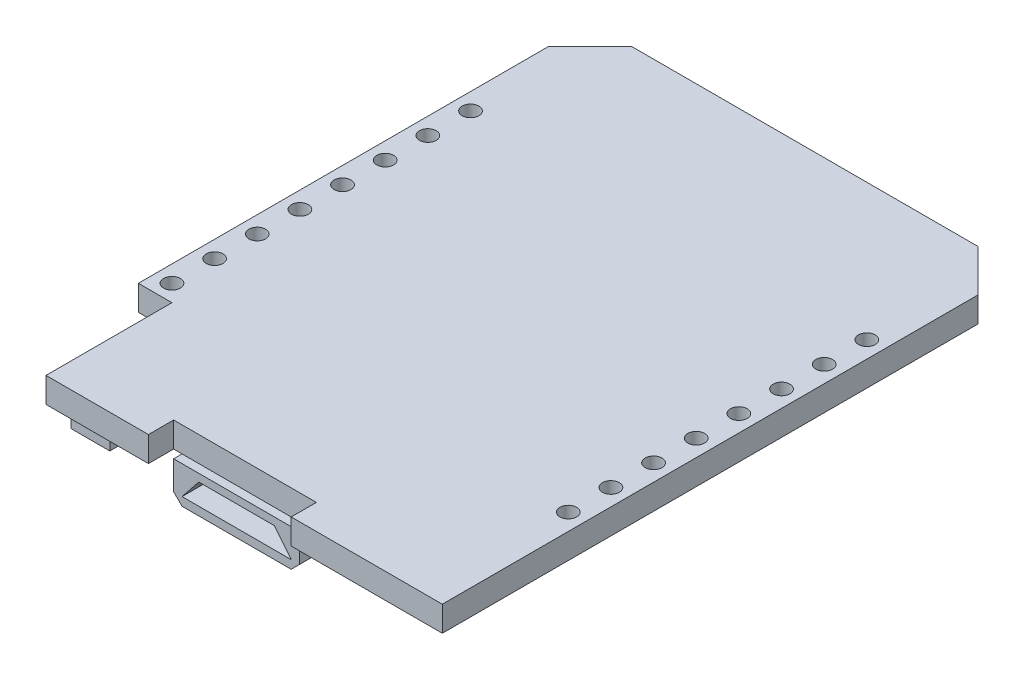
from build123d import *

# Parameters (mm, degrees)
SKETCH1_R             = 0.5
PCB_DEPTH             = 1.5
SKETCH5_W             = 7.5
SKETCH5_H             = 5.6
BOSS_EXTRUDE4_DEPTH   = 2.2
CHAMFER1_SIZE         = 0.5
CUT_EXTRUDE1_DEPTH    = 4
SKETCH5_4_W           = 2.3
SKETCH5_4_H           = 4.5
BUTTON_BODY_DEPTH     = 2
SKETCH11_W            = 2
SKETCH11_H            = 0.89493309
BUTTON_ACTUATOR_DEPTH = 1
SKETCH5_5_W           = 1.5
SKETCH5_5_H           = 1
COMPONENTS1_DEPTH     = 1
SKETCH5_5_W_2         = 10.115707705
SKETCH5_5_H_2         = 4.574950916
COMPONENTS1_2_DEPTH   = 1
COMPONENTS1_3_DEPTH   = 1
COMPONENTS1_4_DEPTH   = 1
SKETCH5_5_W_3         = 1
SKETCH5_5_H_3         = 1.5
COMPONENTS1_5_DEPTH   = 1
SKETCH5_6_W           = 1.5
SKETCH5_6_H           = 1
COMPONENTS_2_DEPTH    = 0.5
COMPONENTS_2_2_DEPTH  = 0.5
COMPONENTS_2_3_DEPTH  = 0.5
COMPONENTS_2_4_DEPTH  = 0.5
COMPONENTS_2_5_DEPTH  = 0.5
COMPONENTS_2_6_DEPTH  = 0.5
COMPONENTS_2_7_DEPTH  = 0.5
COMPONENTS_2_8_DEPTH  = 0.5
COMPONENTS_2_9_DEPTH  = 0.5
SKETCH5_6_W_2         = 1
SKETCH5_6_H_2         = 2.730487257
COMPONENTS_2_10_DEPTH = 0.5
COMPONENTS_2_11_DEPTH = 0.5
SKETCH5_6_H_3         = 1.5
COMPONENTS_2_12_DEPTH = 0.5
COMPONENTS_2_13_DEPTH = 0.5
COMPONENTS_2_14_DEPTH = 0.5
COMPONENTS_2_15_DEPTH = 0.5
COMPONENTS_2_16_DEPTH = 0.5
COMPONENTS_2_17_DEPTH = 0.5
COMPONENTS_2_18_DEPTH = 0.5
COMPONENTS_2_19_DEPTH = 0.5
COMPONENTS_2_20_DEPTH = 0.5
COMPONENTS_2_21_DEPTH = 0.5


with BuildPart() as part:
    # Sketch1 → PCB (new body)
    with BuildSketch(Plane(origin=(0, 0, 0), x_dir=(1, 0, 0), z_dir=(0, 1, 0))):
        Polygon((0, 0), (0, 31.9), (-2.5, 34.4), (-23.1, 34.4), (-25.6, 31.9), (-25.6, 7.5), (-23.6, 7.5), (-23.6, 0), (-17.5, 0), (-17.5, 1.5), (-9, 1.5), (-9, 0), align=None)
        with Locations(Location((-24.6, 8.5, 0), (0, 0, 270))):
            Circle(SKETCH1_R, mode=Mode.SUBTRACT)
        with Locations(Location((-1, 8.5, 0), (0, 0, 270))):
            Circle(SKETCH1_R, mode=Mode.SUBTRACT)
        with Locations(Location((-24.6, 11.04, 0), (0, 0, 270))):
            Circle(SKETCH1_R, mode=Mode.SUBTRACT)
        with Locations(Location((-1, 11.04, 0), (0, 0, 270))):
            Circle(SKETCH1_R, mode=Mode.SUBTRACT)
        with Locations(Location((-24.6, 13.58, 0), (0, 0, 270))):
            Circle(SKETCH1_R, mode=Mode.SUBTRACT)
        with Locations(Location((-1, 13.58, 0), (0, 0, 270))):
            Circle(SKETCH1_R, mode=Mode.SUBTRACT)
        with Locations(Location((-24.6, 16.12, 0), (0, 0, 270))):
            Circle(SKETCH1_R, mode=Mode.SUBTRACT)
        with Locations(Location((-1, 16.12, 0), (0, 0, 270))):
            Circle(SKETCH1_R, mode=Mode.SUBTRACT)
        with Locations(Location((-24.6, 18.66, 0), (0, 0, 270))):
            Circle(SKETCH1_R, mode=Mode.SUBTRACT)
        with Locations(Location((-1, 18.66, 0), (0, 0, 270))):
            Circle(SKETCH1_R, mode=Mode.SUBTRACT)
        with Locations(Location((-24.6, 21.2, 0), (0, 0, 270))):
            Circle(SKETCH1_R, mode=Mode.SUBTRACT)
        with Locations(Location((-1, 21.2, 0), (0, 0, 270))):
            Circle(SKETCH1_R, mode=Mode.SUBTRACT)
        with Locations(Location((-24.6, 23.74, 0), (0, 0, 270))):
            Circle(SKETCH1_R, mode=Mode.SUBTRACT)
        with Locations(Location((-1, 23.74, 0), (0, 0, 270))):
            Circle(SKETCH1_R, mode=Mode.SUBTRACT)
        with Locations(Location((-24.6, 26.28, 0), (0, 0, 270))):
            Circle(SKETCH1_R, mode=Mode.SUBTRACT)
        with Locations(Location((-1, 26.28, 0), (0, 0, 270))):
            Circle(SKETCH1_R, mode=Mode.SUBTRACT)
    extrude(amount=PCB_DEPTH)


with BuildPart() as body_2:
    # Sketch5 → Boss-Extrude4 (new body)
    with BuildSketch(Plane.XZ):
        with Locations((-13.25, -3.8)):
            Rectangle(SKETCH5_W, SKETCH5_H)
    extrude(amount=BOSS_EXTRUDE4_DEPTH)

    # Chamfer1
    chamfer1_edges = [body_2.edges().sort_by_distance(p)[0] for p in [
        (-17, -2.2, -3.8),
        (-9.5, -2.2, -3.8),
    ]]
    chamfer(chamfer1_edges, length=CHAMFER1_SIZE)

    # Sketch12 → Cut-Extrude1 (cut)
    with BuildSketch(Plane.XY.offset(-1)):
        Polygon((-15.5, -0.45), (-11, -0.45), (-10, -1.7), (-16.5, -1.7), align=None)
    extrude(amount=-CUT_EXTRUDE1_DEPTH, mode=Mode.SUBTRACT)


with BuildPart() as body_3:
    # Sketch5<4> → Button Body (new body)
    with BuildSketch(Plane.XZ):
        with Locations((-22.45, -3.75)):
            Rectangle(SKETCH5_4_W, SKETCH5_4_H)
    extrude(amount=BUTTON_BODY_DEPTH)


with BuildPart() as body_4:
    # Sketch11 → Button Actuator (new body)
    with BuildSketch(Plane.ZY.offset(23.6)):
        with Locations((-3.75, -1)):
            Rectangle(SKETCH11_W, SKETCH11_H)
    extrude(amount=BUTTON_ACTUATOR_DEPTH)


with BuildPart() as body_5:
    # Sketch5<5> → Components1 (new body)
    with BuildSketch(Plane.XZ):
        with Locations((-3.164431534, -3.205591578)):
            Rectangle(SKETCH5_5_W, SKETCH5_5_H)
    extrude(amount=COMPONENTS1_DEPTH)


with BuildPart() as body_6:
    # Sketch5<5> → Components1 2 (new body)
    with BuildSketch(Plane.XZ):
        with Locations((-13.706412385, -12.112524542)):
            Rectangle(SKETCH5_5_W_2, SKETCH5_5_H_2)
    extrude(amount=COMPONENTS1_2_DEPTH)


with BuildPart() as body_7:
    # Sketch5<5> → Components1 3 (new body)
    with BuildSketch(Plane.XZ):
        with Locations((-12.85, -27.9)):
            Rectangle(SKETCH5_5_W, SKETCH5_5_H)
    extrude(amount=COMPONENTS1_3_DEPTH)


with BuildPart() as body_8:
    # Sketch5<5> → Components1 4 (new body)
    with BuildSketch(Plane.XZ):
        with Locations((-12.85, -17.9)):
            Rectangle(SKETCH5_5_W, SKETCH5_5_H)
    extrude(amount=COMPONENTS1_4_DEPTH)


with BuildPart() as body_9:
    # Sketch5<5> → Components1 5 (new body)
    with BuildSketch(Plane.XZ):
        with Locations((-7.859161772, -2.586878922)):
            Rectangle(SKETCH5_5_W_3, SKETCH5_5_H_3)
    extrude(amount=COMPONENTS1_5_DEPTH)


with BuildPart() as body_10:
    # Sketch5<6> → Components 2 (new body)
    with BuildSketch(Plane.XZ):
        with Locations((-19.35, -15.9)):
            Rectangle(SKETCH5_6_W, SKETCH5_6_H)
    extrude(amount=COMPONENTS_2_DEPTH)


with BuildPart() as body_11:
    # Sketch5<6> → Components 2 2 (new body)
    with BuildSketch(Plane.XZ):
        with Locations((-19.35, -17.9)):
            Rectangle(SKETCH5_6_W, SKETCH5_6_H)
    extrude(amount=COMPONENTS_2_2_DEPTH)


with BuildPart() as body_12:
    # Sketch5<6> → Components 2 3 (new body)
    with BuildSketch(Plane.XZ):
        with Locations((-19.35, -19.9)):
            Rectangle(SKETCH5_6_W, SKETCH5_6_H)
    extrude(amount=COMPONENTS_2_3_DEPTH)


with BuildPart() as body_13:
    # Sketch5<6> → Components 2 4 (new body)
    with BuildSketch(Plane.XZ):
        with Locations((-19.35, -21.9)):
            Rectangle(SKETCH5_6_W, SKETCH5_6_H)
    extrude(amount=COMPONENTS_2_4_DEPTH)


with BuildPart() as body_14:
    # Sketch5<6> → Components 2 5 (new body)
    with BuildSketch(Plane.XZ):
        with Locations((-19.35, -23.9)):
            Rectangle(SKETCH5_6_W, SKETCH5_6_H)
    extrude(amount=COMPONENTS_2_5_DEPTH)


with BuildPart() as body_15:
    # Sketch5<6> → Components 2 6 (new body)
    with BuildSketch(Plane.XZ):
        with Locations((-19.35, -25.9)):
            Rectangle(SKETCH5_6_W, SKETCH5_6_H)
    extrude(amount=COMPONENTS_2_6_DEPTH)


with BuildPart() as body_16:
    # Sketch5<6> → Components 2 7 (new body)
    with BuildSketch(Plane.XZ):
        with Locations((-19.35, -27.9)):
            Rectangle(SKETCH5_6_W, SKETCH5_6_H)
    extrude(amount=COMPONENTS_2_7_DEPTH)


with BuildPart() as body_17:
    # Sketch5<6> → Components 2 8 (new body)
    with BuildSketch(Plane.XZ):
        with Locations((-12.85, -23.9)):
            Rectangle(SKETCH5_6_W, SKETCH5_6_H)
    extrude(amount=COMPONENTS_2_8_DEPTH)


with BuildPart() as body_18:
    # Sketch5<6> → Components 2 9 (new body)
    with BuildSketch(Plane.XZ):
        with Locations((-12.85, -21.9)):
            Rectangle(SKETCH5_6_W, SKETCH5_6_H)
    extrude(amount=COMPONENTS_2_9_DEPTH)


with BuildPart() as body_19:
    # Sketch5<6> → Components 2 10 (new body)
    with BuildSketch(Plane.XZ):
        with Locations((-18.856957667, -6.674141125)):
            Rectangle(SKETCH5_6_W_2, SKETCH5_6_H_2)
    extrude(amount=COMPONENTS_2_10_DEPTH)


with BuildPart() as body_20:
    # Sketch5<6> → Components 2 11 (new body)
    with BuildSketch(Plane.XZ):
        with Locations((-4.664431534, -1.336878922)):
            Rectangle(SKETCH5_6_W, SKETCH5_6_H)
    extrude(amount=COMPONENTS_2_11_DEPTH)


with BuildPart() as body_21:
    # Sketch5<6> → Components 2 12 (new body)
    with BuildSketch(Plane.XZ):
        with Locations((-7.752386826, -6.644686373)):
            Rectangle(SKETCH5_6_W_2, SKETCH5_6_H_3)
    extrude(amount=COMPONENTS_2_12_DEPTH)


with BuildPart() as body_22:
    # Sketch5<6> → Components 2 13 (new body)
    with BuildSketch(Plane.XZ):
        with Locations((-3.619512743, -6.732470951)):
            Rectangle(SKETCH5_6_W, SKETCH5_6_H)
    extrude(amount=COMPONENTS_2_13_DEPTH)


with BuildPart() as body_23:
    # Sketch5<6> → Components 2 14 (new body)
    with BuildSketch(Plane.XZ):
        with Locations((-4.976980779, -10.171565746)):
            Rectangle(SKETCH5_6_W_2, SKETCH5_6_H_3)
    extrude(amount=COMPONENTS_2_14_DEPTH)


with BuildPart() as body_24:
    # Sketch5<6> → Components 2 15 (new body)
    with BuildSketch(Plane.XZ):
        with Locations((-6.576760368, -10.171565746)):
            Rectangle(SKETCH5_6_W_2, SKETCH5_6_H_3)
    extrude(amount=COMPONENTS_2_15_DEPTH)


with BuildPart() as body_25:
    # Sketch5<6> → Components 2 16 (new body)
    with BuildSketch(Plane.XZ):
        with Locations((-6.35, -13.9)):
            Rectangle(SKETCH5_6_W, SKETCH5_6_H)
    extrude(amount=COMPONENTS_2_16_DEPTH)


with BuildPart() as body_26:
    # Sketch5<6> → Components 2 17 (new body)
    with BuildSketch(Plane.XZ):
        with Locations((-6.35, -15.9)):
            Rectangle(SKETCH5_6_W, SKETCH5_6_H)
    extrude(amount=COMPONENTS_2_17_DEPTH)


with BuildPart() as body_27:
    # Sketch5<6> → Components 2 18 (new body)
    with BuildSketch(Plane.XZ):
        with Locations((-6.35, -17.9)):
            Rectangle(SKETCH5_6_W, SKETCH5_6_H)
    extrude(amount=COMPONENTS_2_18_DEPTH)


with BuildPart() as body_28:
    # Sketch5<6> → Components 2 19 (new body)
    with BuildSketch(Plane.XZ):
        with Locations((-6.35, -19.9)):
            Rectangle(SKETCH5_6_W, SKETCH5_6_H)
    extrude(amount=COMPONENTS_2_19_DEPTH)


with BuildPart() as body_29:
    # Sketch5<6> → Components 2 20 (new body)
    with BuildSketch(Plane.XZ):
        with Locations((-6.35, -25.9)):
            Rectangle(SKETCH5_6_W, SKETCH5_6_H)
    extrude(amount=COMPONENTS_2_20_DEPTH)


with BuildPart() as body_30:
    # Sketch5<6> → Components 2 21 (new body)
    with BuildSketch(Plane.XZ):
        with Locations((-6.35, -27.9)):
            Rectangle(SKETCH5_6_W, SKETCH5_6_H)
    extrude(amount=COMPONENTS_2_21_DEPTH)


solid = Compound([part.part, body_2.part, body_3.part, body_4.part, body_5.part, body_6.part, body_7.part, body_8.part, body_9.part, body_10.part, body_11.part, body_12.part, body_13.part, body_14.part, body_15.part, body_16.part, body_17.part, body_18.part, body_19.part, body_20.part, body_21.part, body_22.part, body_23.part, body_24.part, body_25.part, body_26.part, body_27.part, body_28.part, body_29.part, body_30.part])
